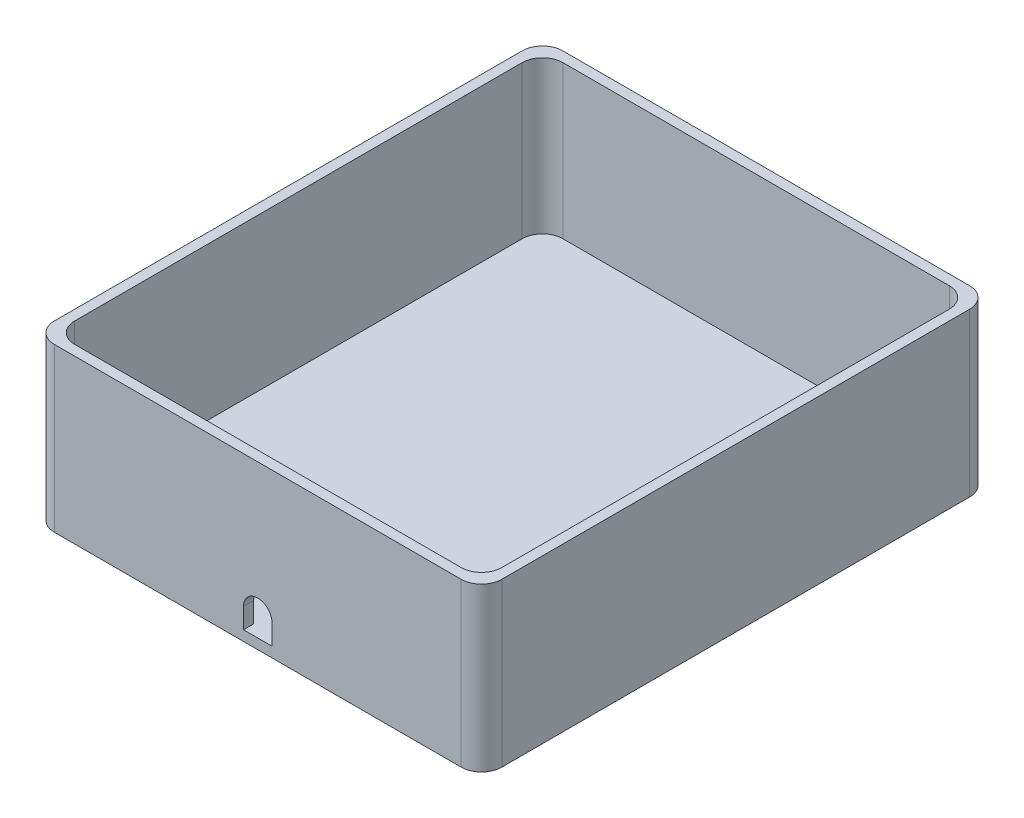
from build123d import *

# Parameters (mm, degrees)
SKETCH2_W           = 220
SKETCH2_H           = 250
BOSS_EXTRUDE2_DEPTH = 80
SKETCH3_W           = 210
SKETCH3_H           = 240
CUT_EXTRUDE1_DEPTH  = 75
FILLET1_R           = 10
CUT_EXTRUDE2_DEPTH  = 75


with BuildPart() as part:
    # Sketch2 → Boss-Extrude2 (new body)
    with BuildSketch(Plane(origin=(0, 0, 0), x_dir=(1, 0, 0), z_dir=(0, 1, 0))):
        Rectangle(SKETCH2_W, SKETCH2_H)
    extrude(amount=BOSS_EXTRUDE2_DEPTH)

    # Sketch3 → Cut-Extrude1 (cut)
    with BuildSketch(Plane(origin=(0, 80, 0), x_dir=(1, 0, 0), z_dir=(0, 1, 0))):
        Rectangle(SKETCH3_W, SKETCH3_H)
    extrude(amount=-CUT_EXTRUDE1_DEPTH, mode=Mode.SUBTRACT)

    # Fillet1
    fillet1_edges = [part.edges().sort_by_distance(p)[0] for p in [
        (-105, 42.5, 120),
        (-105, 42.5, -120),
        (105, 42.5, -120),
        (105, 42.5, 120),
        (-110, 40, -125),
        (110, 40, -125),
        (110, 40, 125),
        (-110, 40, 125),
    ]]
    fillet(fillet1_edges, radius=FILLET1_R)

    # Sketch4 → Cut-Extrude2 (cut)
    with BuildSketch(Plane.XY.offset(125)):
        with BuildLine():
            Line((-7, 5), (-7, 15))
            ThreePointArc((-7, 15), (0, 22), (7, 15))
            Line((7, 15), (7, 5))
            Line((7, 5), (-7, 5))
        make_face()
    extrude(amount=-CUT_EXTRUDE2_DEPTH, mode=Mode.SUBTRACT)


solid = part.part
